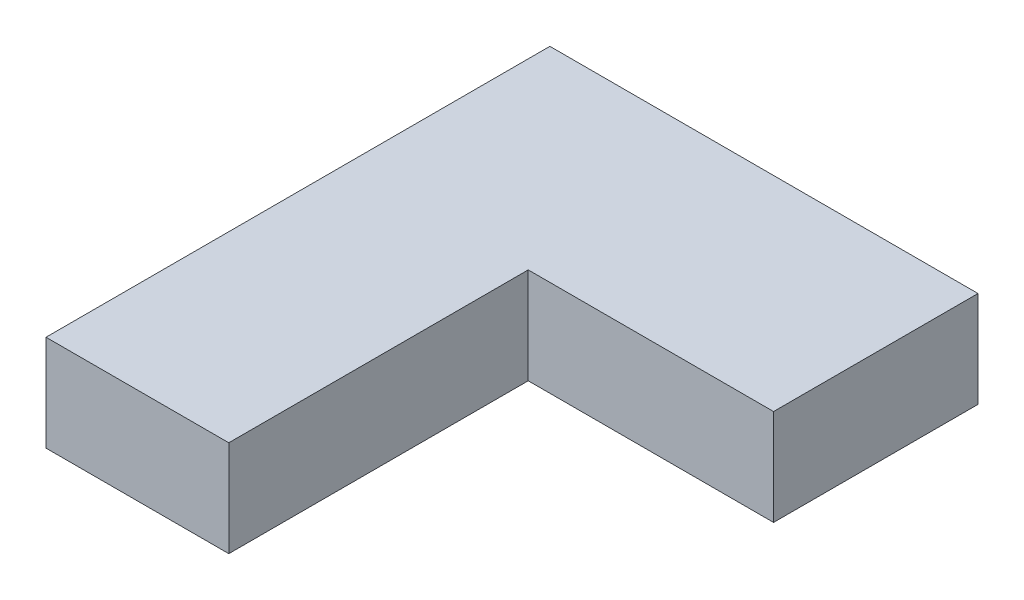
from build123d import *

# Parameters (mm, degrees)
BOSS_EXTRUDE1_DEPTH = 10


with BuildPart() as part:
    # Sketch1 → Boss-Extrude1 (new body)
    with BuildSketch(Plane.XZ):
        Polygon((44.569011084, -31.173268988), (19.029465407, -31.173268988), (19.029465407, 0), (0, 0), (0, -52.456223719), (44.569011084, -52.456223719), align=None)
    extrude(amount=-BOSS_EXTRUDE1_DEPTH)


solid = part.part
